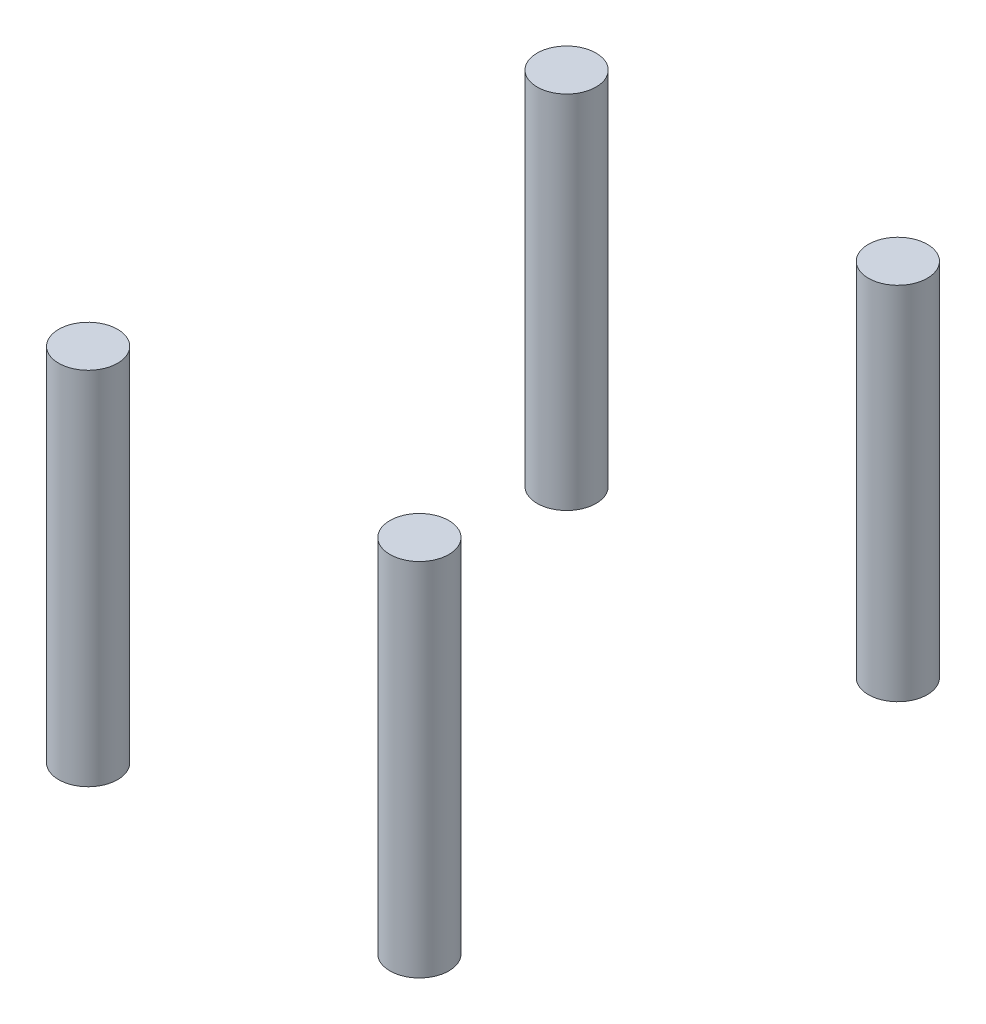
from build123d import *

# Parameters (mm, degrees)
SKETCH1_R             = 4
BOSS_EXTRUDE1_DEPTH   = 49
BOSS_EXTRUDE1_2_DEPTH = 49
BOSS_EXTRUDE1_3_DEPTH = 49
BOSS_EXTRUDE1_4_DEPTH = 49


with BuildPart() as part:
    # Sketch1 → Boss-Extrude1 (new body)
    with BuildSketch(Plane(origin=(0, 0, 0), x_dir=(1, 0, 0), z_dir=(0, 1, 0))):
        with Locations(Location((22.5, -32.5, 0), (0, 0, 270))):
            Circle(SKETCH1_R)
    extrude(amount=BOSS_EXTRUDE1_DEPTH)


with BuildPart() as body_2:
    # Sketch1 → Boss-Extrude1 2 (new body)
    with BuildSketch(Plane(origin=(0, 0, 0), x_dir=(1, 0, 0), z_dir=(0, 1, 0))):
        with Locations(Location((22.5, 32.5, 0), (0, 0, 270))):
            Circle(SKETCH1_R)
    extrude(amount=BOSS_EXTRUDE1_2_DEPTH)


with BuildPart() as body_3:
    # Sketch1 → Boss-Extrude1 3 (new body)
    with BuildSketch(Plane(origin=(0, 0, 0), x_dir=(1, 0, 0), z_dir=(0, 1, 0))):
        with Locations(Location((-22.5, 32.5, 0), (0, 0, 90))):
            Circle(SKETCH1_R)
    extrude(amount=BOSS_EXTRUDE1_3_DEPTH)


with BuildPart() as body_4:
    # Sketch1 → Boss-Extrude1 4 (new body)
    with BuildSketch(Plane(origin=(0, 0, 0), x_dir=(1, 0, 0), z_dir=(0, 1, 0))):
        with Locations(Location((-22.5, -32.5, 0), (0, 0, 90))):
            Circle(SKETCH1_R)
    extrude(amount=BOSS_EXTRUDE1_4_DEPTH)


solid = Compound([part.part, body_2.part, body_3.part, body_4.part])
